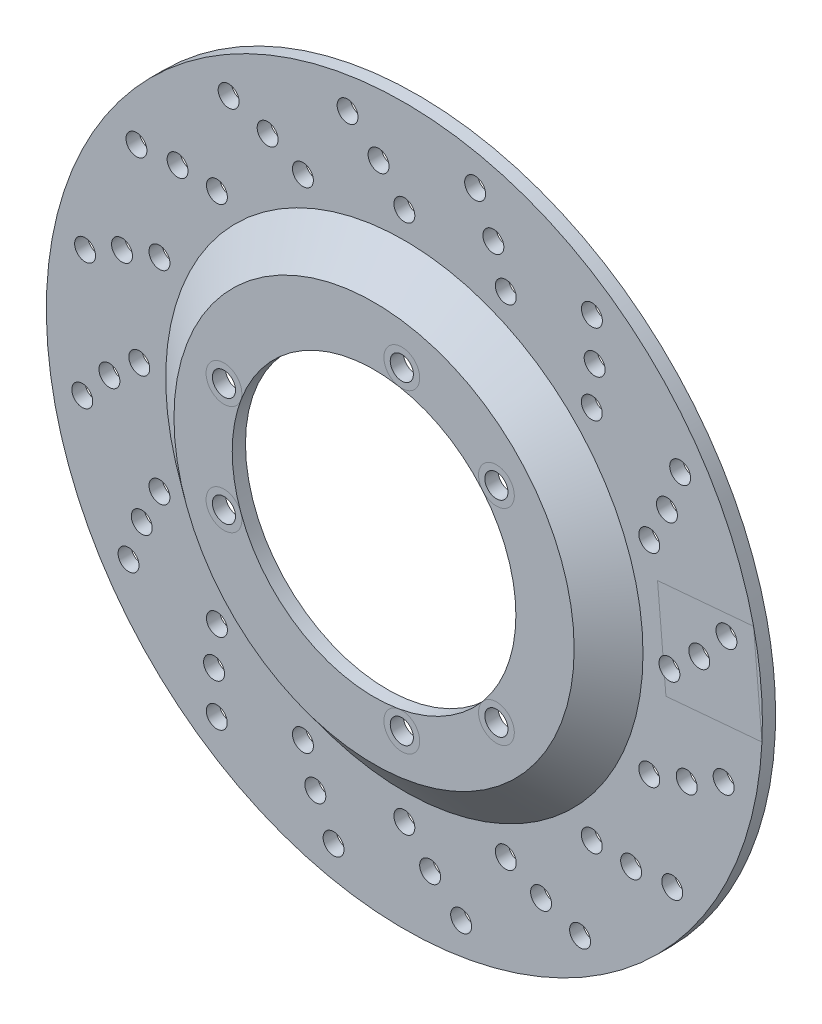
from build123d import *

# Parameters (mm, degrees)
SKETCH3_R                  = 51.5
CUT_EXTRUDE1_DEPTH         = 185.176545738
SKETCH4_R                  = 4.2
CUT_EXTRUDE2_DEPTH         = 185.176545738
F_7_6_7_6_DIAMETER_HOLE1_D = 7.6
CIRPATTERN1_COUNT          = 16


with BuildPart() as part:
    # Sketch2 → Revolve1 (revolve)
    with BuildSketch(Plane(origin=(0, 0, 0), x_dir=(1, 0, 0), z_dir=(0, 1, 0))):
        Polygon((0, 0), (0, 4.8), (-71, 4.8), (-85, 15.8), (-130, 15.8), (-130, 11), (-86.660142756, 11), (-72.660142756, 0), align=None)
    revolve(axis=Axis((0, 0, 0), (0, 0, -1)))

    # Sketch3 → Cut-Extrude1 (cut, through all)
    with BuildSketch(Plane(origin=(0, 0, -4.8), x_dir=(-1, 0, 0), z_dir=(0, 0, -1))):
        Circle(SKETCH3_R)
    extrude(amount=-CUT_EXTRUDE1_DEPTH, mode=Mode.SUBTRACT)

    # Sketch4 → Cut-Extrude2 (cut, through all)
    with BuildSketch(Plane(origin=(0, 0, -4.8), x_dir=(-1, 0, 0), z_dir=(0, 0, -1))):
        with Locations((-10.071594305, -57.118849675)):
            Circle(SKETCH4_R)
        with Locations((-44.430577701, -37.281681362)):
            Circle(SKETCH4_R)
        with Locations((54.502172006, -19.837168313)):
            Circle(SKETCH4_R)
        with Locations((54.502172006, 19.837168313)):
            Circle(SKETCH4_R)
        with Locations((-10.071594305, 57.118849675)):
            Circle(SKETCH4_R)
        with Locations((-44.430577701, 37.281681362)):
            Circle(SKETCH4_R)
    extrude(amount=-CUT_EXTRUDE2_DEPTH, mode=Mode.SUBTRACT)

    # Ø7.6 (7.6) Diameter Hole1 (through all)
    with Locations(Plane(origin=(0, 0, -15.8), x_dir=(-1, 0, 0), z_dir=(0, 0, -1))):
        with Locations((116.94592067, -20.620721098), (96.25, 0), (107.090930045, -9.369242345)):
            f_7_6_7_6_diameter_hole1 = Hole(F_7_6_7_6_DIAMETER_HOLE1_D / 2)

    # CirPattern1: Ø7.6 (7.6) Diameter Hole1 ×16 about axis
    cirpattern1_axis = Axis((0, 0, -4.8), (0, 0, -1))
    for i in range(1, CIRPATTERN1_COUNT):
        add(f_7_6_7_6_diameter_hole1.rotate(cirpattern1_axis, i * 360 / CIRPATTERN1_COUNT), mode=Mode.SUBTRACT)


solid = part.part
